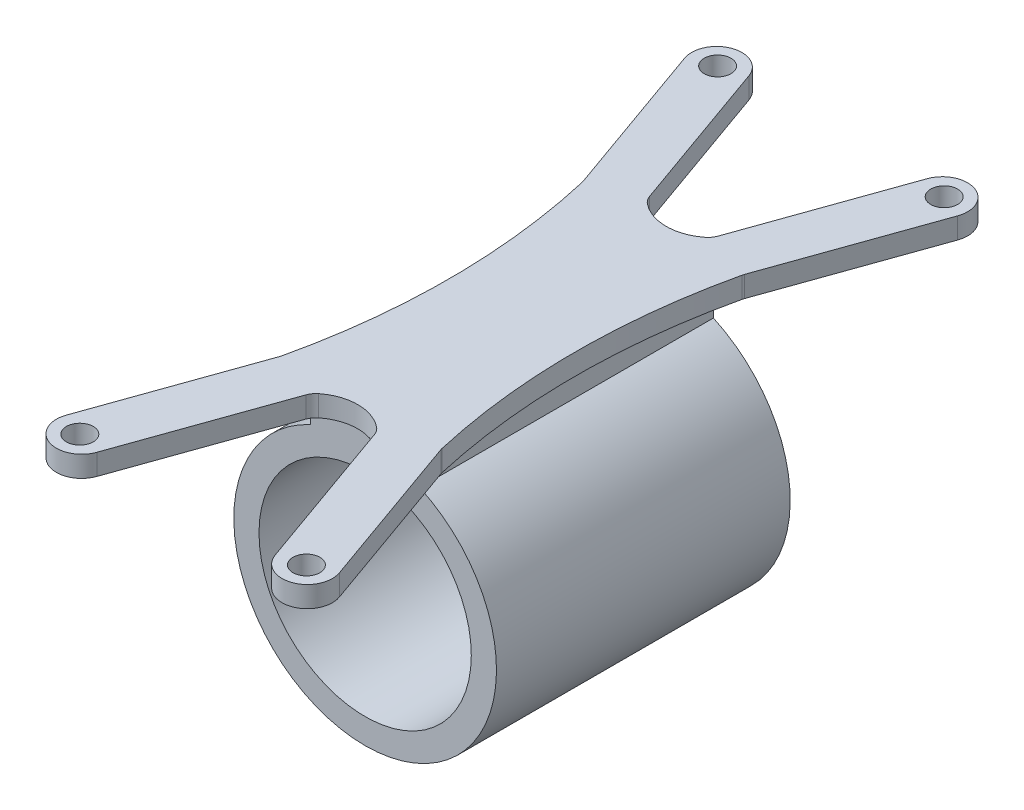
from build123d import *

# Parameters (mm, degrees)
SKETCH1_R                = 15.65
SKETCH1_R_2              = 12.65
BOSS_EXTRUDE1_DEPTH      = 17.5
SKETCH5_R                = 1.6
BOSS_EXTRUDE4_DEPTH      = 2.5
FILLET1_R                = 2
BOSS_EXTRUDE5_REACH      = 57.116
BOSS_EXTRUDE5_END_RADIUS = 15.65
SKETCH6_W                = 13
SKETCH6_H                = 35


with BuildPart() as part:
    # Sketch1 → Boss-Extrude1 (new, symmetric)
    with BuildSketch(Plane.XY):
        Circle(SKETCH1_R)
        Circle(SKETCH1_R_2, mode=Mode.SUBTRACT)
    extrude(amount=BOSS_EXTRUDE1_DEPTH, both=True)



with BuildPart() as body_2:
    # Sketch5 → Boss-Extrude4 (new body)
    # profile 1 of 5: a face of its own
    with BuildSketch(Plane(origin=(0, 20, 0), x_dir=(1, 0, 0), z_dir=(0, 1, 0))):
        with BuildLine():
            Line((-9.576904887, -17.995704843), (-16.272205934, -36.84173742))
            ThreePointArc((-16.272205934, -36.84173742), (-14.449596204, -40.672937463), (-10.618396161, -38.850327734))
            Line((-10.618396161, -38.850327734), (-3.923095113, -20.004295157))
            Line((-3.923095113, -20.004295157), (0, -8.961508912))
            Line((0, -8.961508912), (3.923095113, -20.004295157))
            Line((3.923095113, -20.004295157), (10.618396161, -38.850327734))
            ThreePointArc((10.618396161, -38.850327734), (14.449596204, -40.672937463), (16.272205934, -36.84173742))
            Line((16.272205934, -36.84173742), (9.576904887, -17.995704843))
            Line((9.576904887, -17.995704843), (3.183693955, 0))
            Line((3.183693955, 0), (9.576904887, 17.995704843))
            Line((9.576904887, 17.995704843), (16.272205934, 36.84173742))
            ThreePointArc((16.272205934, 36.84173742), (14.449596204, 40.672937463), (10.618396161, 38.850327734))
            Line((10.618396161, 38.850327734), (3.923095113, 20.004295157))
            Line((3.923095113, 20.004295157), (0, 8.961508912))
            Line((0, 8.961508912), (-3.923095113, 20.004295157))
            Line((-3.923095113, 20.004295157), (-10.618396161, 38.850327734))
            ThreePointArc((-10.618396161, 38.850327734), (-14.449596204, 40.672937463), (-16.272205934, 36.84173742))
            Line((-16.272205934, 36.84173742), (-9.576904887, 17.995704843))
            Line((-9.576904887, 17.995704843), (-3.183693955, 0))
            Line((-3.183693955, 0), (-9.576904887, -17.995704843))
        make_face()
        with Locations(Location((13.5, -38, 0), (0, 0, 270))):
            Circle(SKETCH5_R, mode=Mode.SUBTRACT)
        with Locations(Location((-13.5, -38, 0), (0, 0, 270))):
            Circle(SKETCH5_R, mode=Mode.SUBTRACT)
        with Locations(Location((13.5, 38, 0), (0, 0, 270))):
            Circle(SKETCH5_R, mode=Mode.SUBTRACT)
        with Locations(Location((-13.5, 38, 0), (0, 0, 270))):
            Circle(SKETCH5_R, mode=Mode.SUBTRACT)
    # profile 2 of 5: a face of its own
    with BuildSketch(Plane(origin=(0, 20, 0), x_dir=(1, 0, 0), z_dir=(0, 1, 0))):
        with BuildLine():
            Line((-9.576904887, 17.995704843), (-3.183693955, 0))
            Line((-3.183693955, 0), (-9.576904887, -17.995704843))
            ThreePointArc((-9.576904887, -17.995704843), (-7.526597684, 0), (-9.576904887, 17.995704843))
        make_face()
    # profile 3 of 5: a face of its own
    with BuildSketch(Plane(origin=(0, 20, 0), x_dir=(1, 0, 0), z_dir=(0, 1, 0))):
        with BuildLine():
            ThreePointArc((9.576904887, 17.995704843), (7.526597684, 0), (9.576904887, -17.995704843))
            Line((9.576904887, -17.995704843), (3.183693955, 0))
            Line((3.183693955, 0), (9.576904887, 17.995704843))
        make_face()
    # profile 4 of 5: a face of its own
    with BuildSketch(Plane(origin=(0, 20, 0), x_dir=(1, 0, 0), z_dir=(0, 1, 0))):
        with BuildLine():
            Line((-3.923095113, -20.004295157), (0, -8.961508912))
            Line((0, -8.961508912), (3.923095113, -20.004295157))
            ThreePointArc((3.923095113, -20.004295157), (0, -18.380084852), (-3.923095113, -20.004295157))
        make_face()
    # profile 5 of 5: a face of its own
    with BuildSketch(Plane(origin=(0, 20, 0), x_dir=(1, 0, 0), z_dir=(0, 1, 0))):
        with BuildLine():
            ThreePointArc((-3.923095113, 20.004295157), (0, 18.380084852), (3.923095113, 20.004295157))
            Line((3.923095113, 20.004295157), (0, 8.961508912))
            Line((0, 8.961508912), (-3.923095113, 20.004295157))
        make_face()
    extrude(amount=-BOSS_EXTRUDE4_DEPTH)

    # Fillet1
    fillet1_edges = [body_2.edges().sort_by_distance(p)[0] for p in [
        (-9.576904887, 18.75, -17.995704843),
        (-3.923095113, 18.75, -20.004295157),
        (3.923095113, 18.75, -20.004295157),
        (9.576904887, 18.75, -17.995704843),
        (9.576904887, 18.75, 17.995704843),
        (3.923095113, 18.75, 20.004295157),
        (-3.923095113, 18.75, 20.004295157),
        (-9.576904887, 18.75, 17.995704843),
    ]]
    fillet(fillet1_edges, radius=FILLET1_R)


with BuildPart() as part_1:
    add(part.part)

    add(body_2.part)  # Boss-Extrude5 merges body 2
    # Boss-Extrude5: up to this cylinder (the profile starts outside it)
    boss_extrude5_end = Plane(origin=(0, 0, 0), z_dir=(0, 0, -1)) * Cylinder(BOSS_EXTRUDE5_END_RADIUS, 146.532, mode=Mode.PRIVATE)
    # Sketch6 → Boss-Extrude5 (add, up to the surface)
    with BuildSketch(Plane.XZ.offset(-17.5), mode=Mode.PRIVATE) as boss_extrude5_sk1:
        Rectangle(SKETCH6_W, SKETCH6_H)
    boss_extrude5_tool1 = extrude(boss_extrude5_sk1.sketch, amount=BOSS_EXTRUDE5_REACH, mode=Mode.PRIVATE) - boss_extrude5_end
    add(boss_extrude5_tool1.solids().sort_by_distance((0, 17.5, 0))[0])


solid = part_1.part
